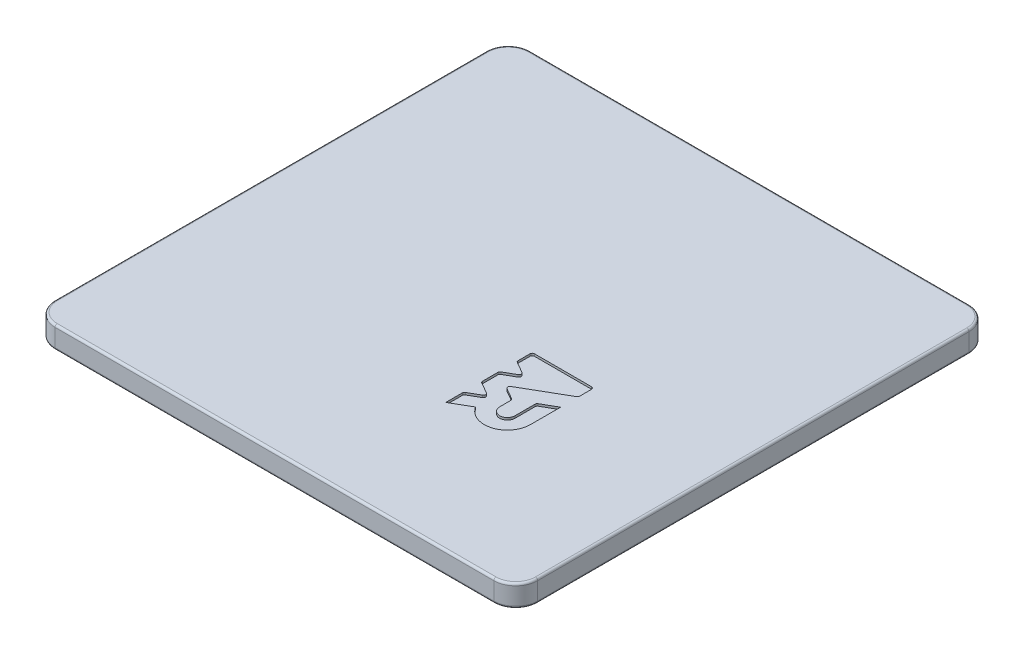
from build123d import *

# Parameters (mm, degrees)
SKETCH1_W           = 219.61751697
SKETCH1_H           = 216.210653226
BOSS_EXTRUDE1_DEPTH = 10
CUT_EXTRUDE1_DEPTH  = 1
FILLET3_R           = 10
FILLET4_R           = 1


with BuildPart() as part:
    # Sketch1 → Boss-Extrude1 (new body)
    with BuildSketch(Plane(origin=(0, 0, 0), x_dir=(1, 0, 0), z_dir=(0, 1, 0))):
        with Locations((-13.550693969, -30.37560711)):
            Rectangle(SKETCH1_W, SKETCH1_H)
    extrude(amount=BOSS_EXTRUDE1_DEPTH)

    # Sketch2 → Cut-Extrude1 (cut)
    with BuildSketch(Plane(origin=(0, 10, 0), x_dir=(1, 0, 0), z_dir=(0, 1, 0))):
        with BuildLine():
            Line((34.100948693, -47.24181379), (34.100948693, -40.819164059))
            Line((34.100948693, -40.819164059), (6.100948693, -40.819164059))
            Line((6.100948693, -40.819164059), (6.100948693, -47.24181379))
            ThreePointArc((6.100948693, -47.24181379), (6.234923289, -47.74181379), (6.600948693, -48.107839194))
            Line((6.600948693, -48.107839194), (13.100948693, -51.860615944))
            Line((13.100948693, -51.860615944), (20.100948693, -55.902067828))
            Line((20.100948693, -55.902067828), (33.600948693, -48.107839194))
            ThreePointArc((33.600948693, -48.107839194), (33.966974097, -47.74181379), (34.100948693, -47.24181379))
        make_face()
        with BuildLine():
            Line((13.100948693, -59.943519712), (20.100948693, -55.902067828))
            Line((20.100948693, -55.902067828), (13.100948693, -51.860615944))
            Line((13.100948693, -51.860615944), (6.600948693, -55.613392693))
            ThreePointArc((6.600948693, -55.613392693), (6.234923289, -55.979418097), (6.100948693, -56.479418097))
            Line((6.100948693, -56.479418097), (6.100948693, -63.407621327))
            ThreePointArc((6.100948693, -63.407621327), (6.234923289, -63.907621327), (6.600948693, -64.273646731))
            Line((6.600948693, -64.273646731), (13.100948693, -68.026423481))
            Line((13.100948693, -68.026423481), (20.100948693, -63.984971597))
            Line((20.100948693, -63.984971597), (13.100948693, -59.943519712))
        make_face()
        with BuildLine():
            Line((20.100948693, -69.650779134), (20.100948693, -63.984971597))
            Line((20.100948693, -63.984971597), (13.100948693, -68.026423481))
            Line((13.100948693, -68.026423481), (6.600948693, -71.779200231))
            ThreePointArc((6.600948693, -71.779200231), (6.234923289, -72.145225634), (6.100948693, -72.645225634))
            Line((6.100948693, -72.645225634), (6.100948693, -80.150779134))
            Line((6.100948693, -80.150779134), (13.100948693, -76.10932725))
            Line((13.100948693, -76.10932725), (13.100948693, -69.650779134))
            ThreePointArc((13.100948693, -69.650779134), (13.504510857, -72.533823188), (14.684175934, -75.195250576))
            ThreePointArc((14.684175934, -75.195250576), (26.483992747, -79.74721697), (34.100948693, -69.650779134))
            Line((34.100948693, -69.650779134), (34.100948693, -55.902067828))
            Line((34.100948693, -55.902067828), (27.600948693, -59.654844578))
            ThreePointArc((27.600948693, -59.654844578), (27.234923289, -60.020869982), (27.100948693, -60.520869982))
            Line((27.100948693, -60.520869982), (27.100948693, -69.650779134))
            ThreePointArc((27.100948693, -69.650779134), (23.600948693, -73.150779134), (20.100948693, -69.650779134))
        make_face()
        with BuildLine():
            Line((13.100948693, -69.650779134), (13.100948693, -76.10932725))
            Line((13.100948693, -76.10932725), (14.684175934, -75.195250576))
            ThreePointArc((14.684175934, -75.195250576), (13.504510857, -72.533823188), (13.100948693, -69.650779134))
        make_face()
    extrude(amount=-CUT_EXTRUDE1_DEPTH, mode=Mode.SUBTRACT)

    # Fillet3
    fillet3_edges = [part.edges().sort_by_distance(p)[0] for p in [
        (-123.359452454, 5, -77.729719503),
        (96.258064516, 5, -77.729719503),
        (96.258064516, 5, 138.480933723),
        (-123.359452454, 5, 138.480933723),
    ]]
    fillet(fillet3_edges, radius=FILLET3_R)

    # Fillet4
    fillet4_edges = [part.edges().sort_by_distance(p)[0] for p in [
        (13.100948693, 9.5, 68.026423481),
        (13.100948693, 9.5, 51.860615944),
        (6.100948693, 9.5, 40.819164059),
        (34.100948693, 9.5, 40.819164059),
        (13.100948693, 9.5, 59.943519712),
        (20.100948693, 9.5, 63.984971597),
        (-13.550693969, 0, -77.729719503),
        (-13.550693969, 10, -77.729719503),
        (-123.359452454, 0, 30.37560711),
        (96.258064516, 0, 30.37560711),
        (-13.550693969, 0, 138.480933723),
        (93.329132328, 0, 135.552001535),
        (-120.430520266, 0, 135.552001535),
        (-120.430520266, 0, -74.800787315),
        (93.329132328, 0, -74.800787315),
        (96.258064516, 10, 30.37560711),
        (-123.359452454, 10, 30.37560711),
        (-13.550693969, 10, 138.480933723),
        (93.329132328, 10, 135.552001535),
        (-120.430520266, 10, 135.552001535),
        (-120.430520266, 10, -74.800787315),
        (93.329132328, 10, -74.800787315),
    ]]
    fillet(fillet4_edges, radius=FILLET4_R)


solid = part.part
